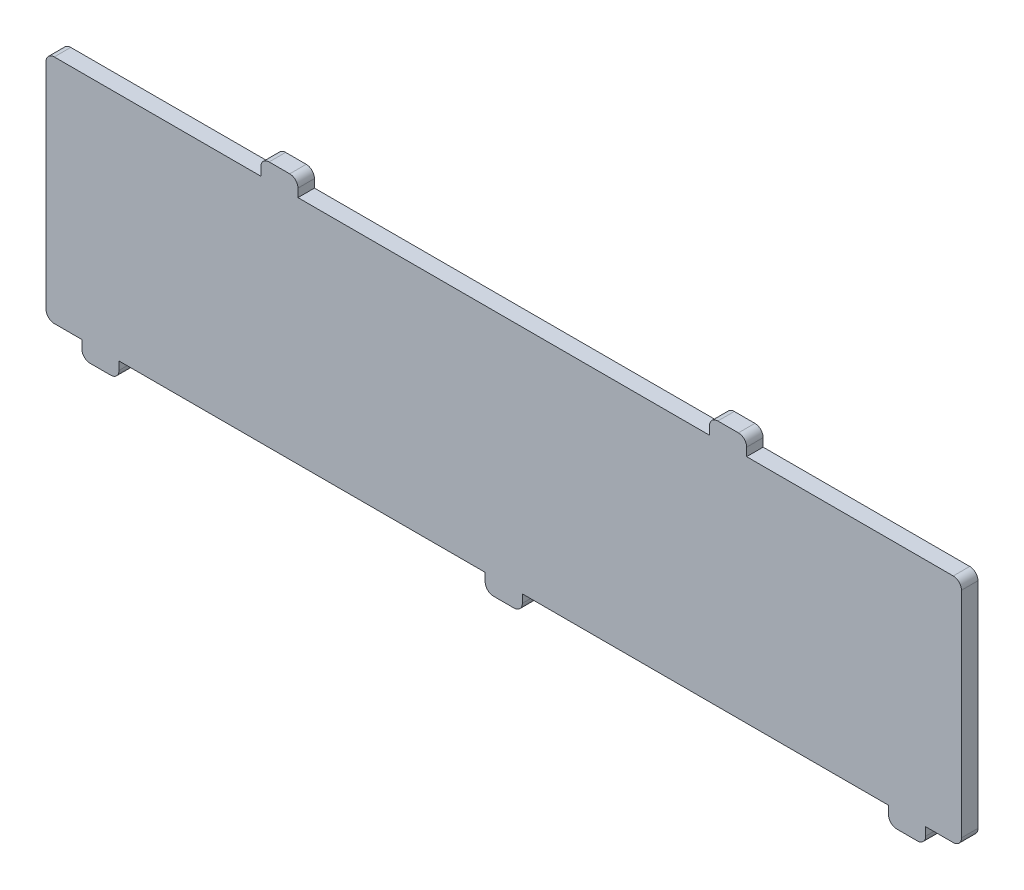
from build123d import *

# Parameters (mm, degrees)
SKETCH1_W           = 111
SKETCH1_H           = 28
SKETCH1_W_2         = 4.5
SKETCH1_H_2         = 2
BOSS_EXTRUDE1_DEPTH = 1
FILLET1_R           = 1


with BuildPart() as part:
    # Sketch1 → Boss-Extrude1 (new, symmetric)
    with BuildSketch(Plane.XY):
        Rectangle(SKETCH1_W, SKETCH1_H)
        with Locations((0, -15)):
            Rectangle(SKETCH1_W_2, SKETCH1_H_2)
        with Locations((27.2, 15)):
            Rectangle(SKETCH1_W_2, SKETCH1_H_2)
        with Locations((-27.2, 15)):
            Rectangle(SKETCH1_W_2, SKETCH1_H_2)
        with Locations((-48.9, -15)):
            Rectangle(SKETCH1_W_2, SKETCH1_H_2)
        with Locations((48.9, -15)):
            Rectangle(SKETCH1_W_2, SKETCH1_H_2)
    extrude(amount=BOSS_EXTRUDE1_DEPTH, both=True)

    # Fillet1
    fillet1_edges = [part.edges().sort_by_distance(p)[0] for p in [
        (55.5, -14, 0),
        (2.25, -16, 0),
        (-2.25, -16, 0),
        (-55.5, -14, 0),
        (-55.5, 14, 0),
        (-29.45, 16, 0),
        (-24.95, 16, 0),
        (24.95, 16, 0),
        (29.45, 16, 0),
        (55.5, 14, 0),
        (-51.15, -16, 0),
        (-46.65, -16, 0),
        (46.65, -16, 0),
        (51.15, -16, 0),
    ]]
    fillet(fillet1_edges, radius=FILLET1_R)


solid = part.part
